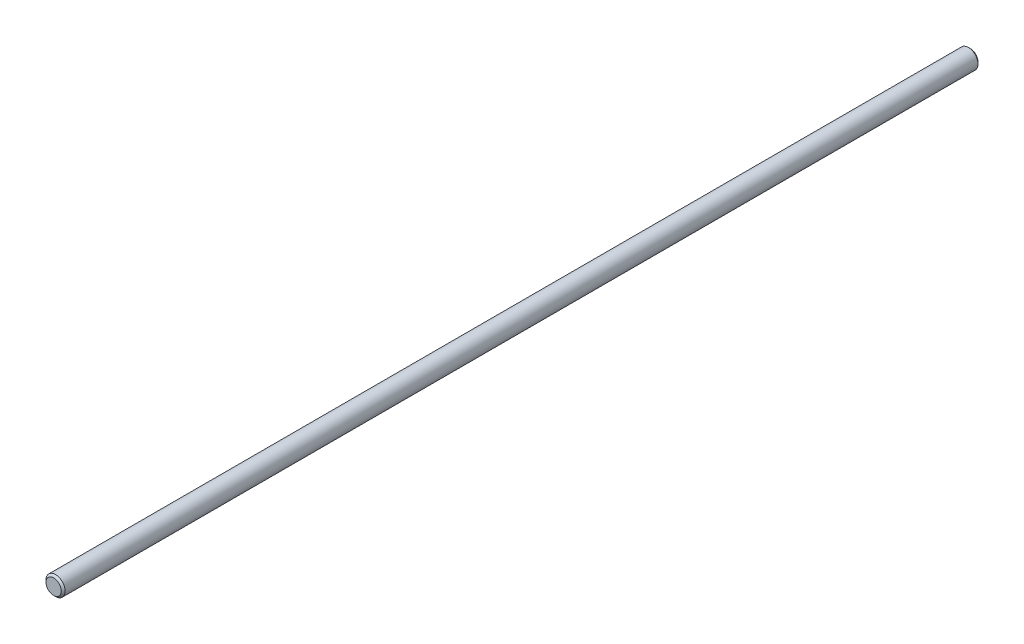
from build123d import *

# Parameters (mm, degrees)
SKETCH3_R           = 1.5875
BOSS_EXTRUDE1_DEPTH = 76.2
CHAMFER1_SIZE       = 0.3175


with BuildPart() as part:
    # Sketch3 → Boss-Extrude1 (new, symmetric)
    with BuildSketch(Plane.XY):
        with Locations(Location((0, 0, 0), (0, 0, 180))):
            Circle(SKETCH3_R)
    extrude(amount=BOSS_EXTRUDE1_DEPTH, both=True)

    # Chamfer1
    chamfer1_edges = [part.edges().sort_by_distance(p)[0] for p in [
        (1.5875, 0, -76.2),
        (1.5875, 0, 76.2),
    ]]
    chamfer(chamfer1_edges, length=CHAMFER1_SIZE)


solid = part.part
